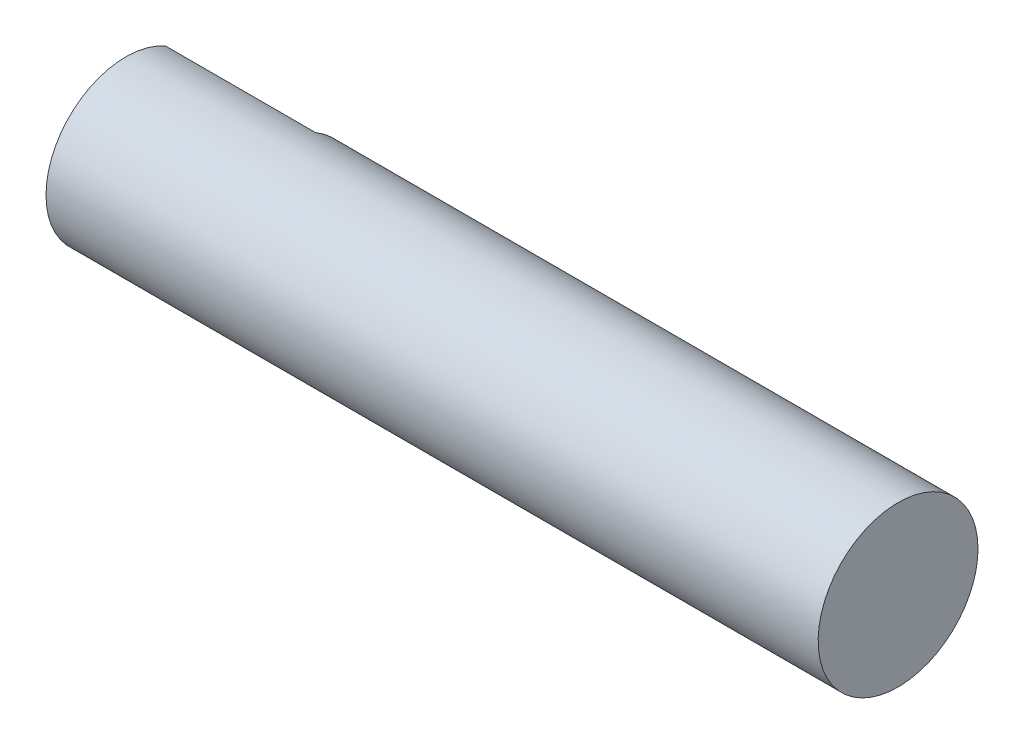
from build123d import *

# Parameters (mm, degrees)
BOSS_EXTRUDE1_DEPTH = 7.5
SKETCH2_R           = 3.995
BOSS_EXTRUDE2_DEPTH = 31.1


with BuildPart() as part:
    # Sketch1 → Boss-Extrude1 (new body)
    with BuildSketch(Plane(origin=(0, 0, 0), x_dir=(0, 0, -1), z_dir=(1, 0, 0))):
        with BuildLine():
            Line((1.985, 3.466958321), (1.985, -3.466958321))
            ThreePointArc((1.985, -3.466958321), (-3.995, 0), (1.985, 3.466958321))
        make_face()
    extrude(amount=BOSS_EXTRUDE1_DEPTH)

    # Sketch2 → Boss-Extrude2 (add)
    with BuildSketch(Plane(origin=(7.5, 0, 0), x_dir=(0, 0, -1), z_dir=(1, 0, 0))):
        with Locations(Location((0, 0, 0), (0, 0, 299.79320791))):
            Circle(SKETCH2_R)
    extrude(amount=BOSS_EXTRUDE2_DEPTH)


solid = part.part
